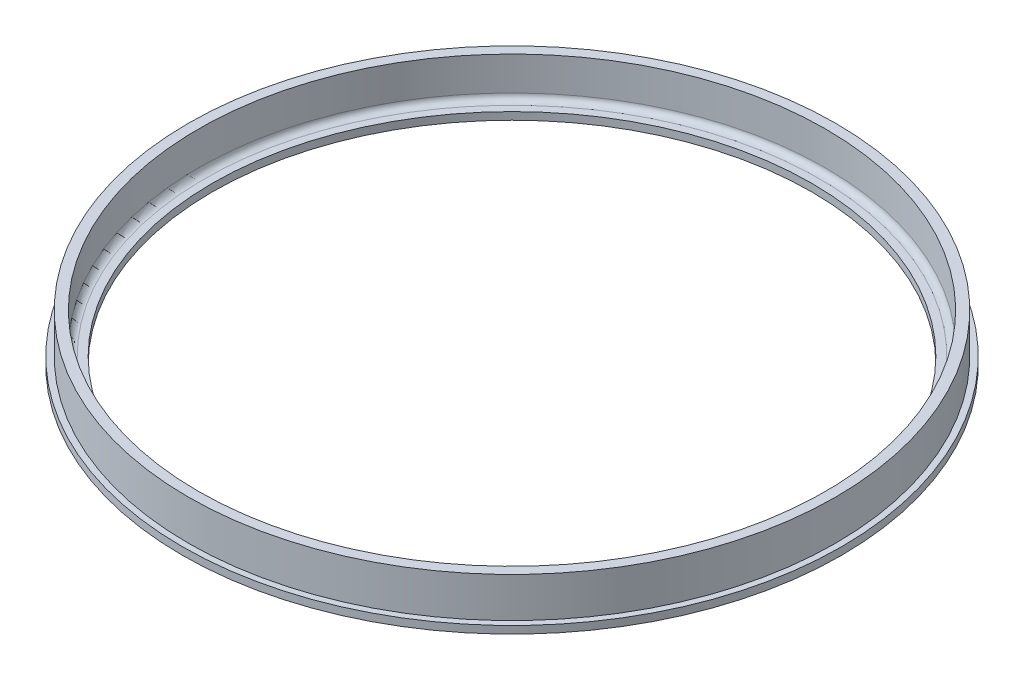
from build123d import *

# Parameters (mm, degrees)
CUT_EXTRUDE1_START = -10.16
SKETCH2_R          = 79.756
SKETCH2_R_2        = 76.2
CUT_EXTRUDE1_DEPTH = 10.16
FILLET1_R          = 1.5875


with BuildPart() as part:
    # Sketch1 → Revolve1 (revolve)
    with BuildSketch(Plane.XY, mode=Mode.PRIVATE) as revolve1_sk:
        Polygon((-83.82, -19.330547638), (-83.82, -17.425547638), (-82.296, -17.425547638), (-82.296, -7.265547638), (-76.2, -7.265547638), (-76.2, -17.425547638), (-76.2, -19.330547638), align=None)
    revolve(revolve1_sk.sketch.rotate(Axis((0, 0, 0), (0, 1, 0)), 270), axis=Axis((0, 0, 0), (0, 1, 0)))

    # Sketch2 → Cut-Extrude1 (cut)
    with BuildSketch(Plane(origin=(0, -7.265547638, 0), x_dir=(1, 0, 0), z_dir=(0, 1, 0)).offset(CUT_EXTRUDE1_START)):
        with Locations(Location((0, 0, 0), (0, 0, 270))):
            Circle(SKETCH2_R)
        with Locations(Location((0, 0, 0), (0, 0, 90))):
            Circle(SKETCH2_R_2, mode=Mode.SUBTRACT)
    extrude(amount=CUT_EXTRUDE1_DEPTH, mode=Mode.SUBTRACT)

    # Fillet1
    fillet1_edges = [part.edges().sort_by_distance(p)[0] for p in [
        (0, -17.425547638, -79.756),
    ]]
    fillet(fillet1_edges, radius=FILLET1_R)


solid = part.part
